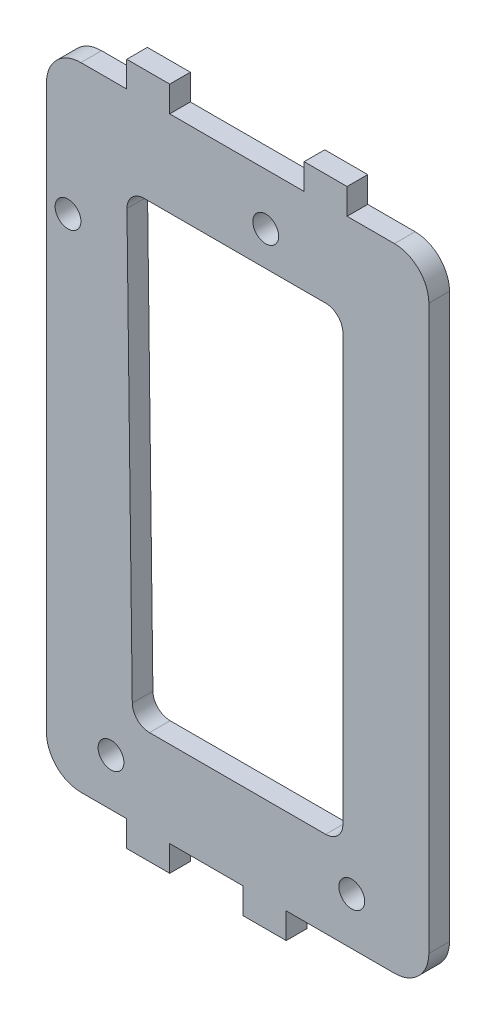
from build123d import *

# Parameters (mm, degrees)
CROQUIS1_R              = 1.5
SALIENTE_EXTRUIR1_DEPTH = 2.4
CORTAR_EXTRUIR1_REACH   = 82.193
CROQUIS2_R              = 1.5


with BuildPart() as part:
    # Croquis1 → Saliente-Extruir1 (new body)
    with BuildSketch(Plane.XY):
        with BuildLine():
            Line((-27.735211809, 52.645866632), (-43.365211809, 52.645866632))
            Line((-43.365211809, 52.645866632), (-43.365211809, 55.645866632))
            Line((-43.365211809, 55.645866632), (-48.365211809, 55.645866632))
            Line((-48.365211809, 55.645866632), (-48.365211809, 52.645866632))
            Line((-48.365211809, 52.645866632), (-53.695211809, 52.645866632))
            ThreePointArc((-53.695211809, 52.645866632), (-56.523638933, 51.474293757), (-57.695211809, 48.645866632))
            Line((-57.695211809, 48.645866632), (-57.695211809, -16.854133368))
            ThreePointArc((-57.695211809, -16.854133368), (-56.523638933, -19.682560493), (-53.695211809, -20.854133368))
            Line((-53.695211809, -20.854133368), (-48.365211809, -20.854133368))
            Line((-48.365211809, -20.854133368), (-48.365211809, -23.854133368))
            Line((-48.365211809, -23.854133368), (-43.365211809, -23.854133368))
            Line((-43.365211809, -23.854133368), (-43.365211809, -20.854133368))
            Line((-43.365211809, -20.854133368), (-34.815211809, -20.854133368))
            Line((-34.815211809, -20.854133368), (-34.815211809, -23.854133368))
            Line((-34.815211809, -23.854133368), (-29.815211809, -23.854133368))
            Line((-29.815211809, -23.854133368), (-29.815211809, -20.854133368))
            Line((-29.815211809, -20.854133368), (-17.225211809, -20.854133368))
            ThreePointArc((-17.225211809, -20.854133368), (-14.396784684, -19.682560493), (-13.225211809, -16.854133368))
            Line((-13.225211809, -16.854133368), (-13.225211809, 48.645866632))
            ThreePointArc((-13.225211809, 48.645866632), (-14.396784684, 51.474293757), (-17.225211809, 52.645866632))
            Line((-17.225211809, 52.645866632), (-22.735211809, 52.645866632))
            Line((-22.735211809, 52.645866632), (-22.735211809, 55.645866632))
            Line((-22.735211809, 55.645866632), (-27.735211809, 55.645866632))
            Line((-27.735211809, 55.645866632), (-27.735211809, 52.645866632))
        make_face()
        with Locations((-55.195211809, 36.645866632)):
            Circle(CROQUIS1_R, mode=Mode.SUBTRACT)
        with Locations((-50.195211809, -15.354133368)):
            Circle(CROQUIS1_R, mode=Mode.SUBTRACT)
        with Locations((-22.195211809, -15.354133368)):
            Circle(CROQUIS1_R, mode=Mode.SUBTRACT)
        with BuildLine():
            Line((-35.550211809, 42.645866632), (-25.225211809, 42.645866632))
            ThreePointArc((-25.225211809, 42.645866632), (-23.810998246, 42.060080194), (-23.225211809, 40.645866632))
            Line((-23.225211809, 40.645866632), (-23.225211809, -8.854133368))
            ThreePointArc((-23.225211809, -8.854133368), (-23.810998246, -10.26834693), (-25.225211809, -10.854133368))
            Line((-25.225211809, -10.854133368), (-45.720101709, -10.854133368))
            ThreePointArc((-45.720101709, -10.854133368), (-47.125432715, -10.277174044), (-47.719944893, -8.879178133))
            Line((-47.719944893, -8.879178133), (-48.339851435, 40.620821867))
            ThreePointArc((-48.339851435, 40.620821867), (-47.763048927, 42.051197638), (-46.340008251, 42.645866632))
            Line((-46.340008251, 42.645866632), (-35.550211809, 42.645866632))
        make_face(mode=Mode.SUBTRACT)
    extrude(amount=SALIENTE_EXTRUIR1_DEPTH)

    # Croquis2 → Cortar-Extruir1 (cut, up to next)
    with BuildSketch(Plane.XY.offset(2.4), mode=Mode.PRIVATE) as cortar_extruir1_sk1:
        with Locations((-32.195211809, 46.645866632)):
            Circle(CROQUIS2_R)
    cortar_extruir1_tool1 = extrude(cortar_extruir1_sk1.sketch, amount=-CORTAR_EXTRUIR1_REACH, mode=Mode.PRIVATE) & part.part
    add(cortar_extruir1_tool1.solids().sort_by_distance((-32.195212, 46.645867, 2.4))[0], mode=Mode.SUBTRACT)


solid = part.part
